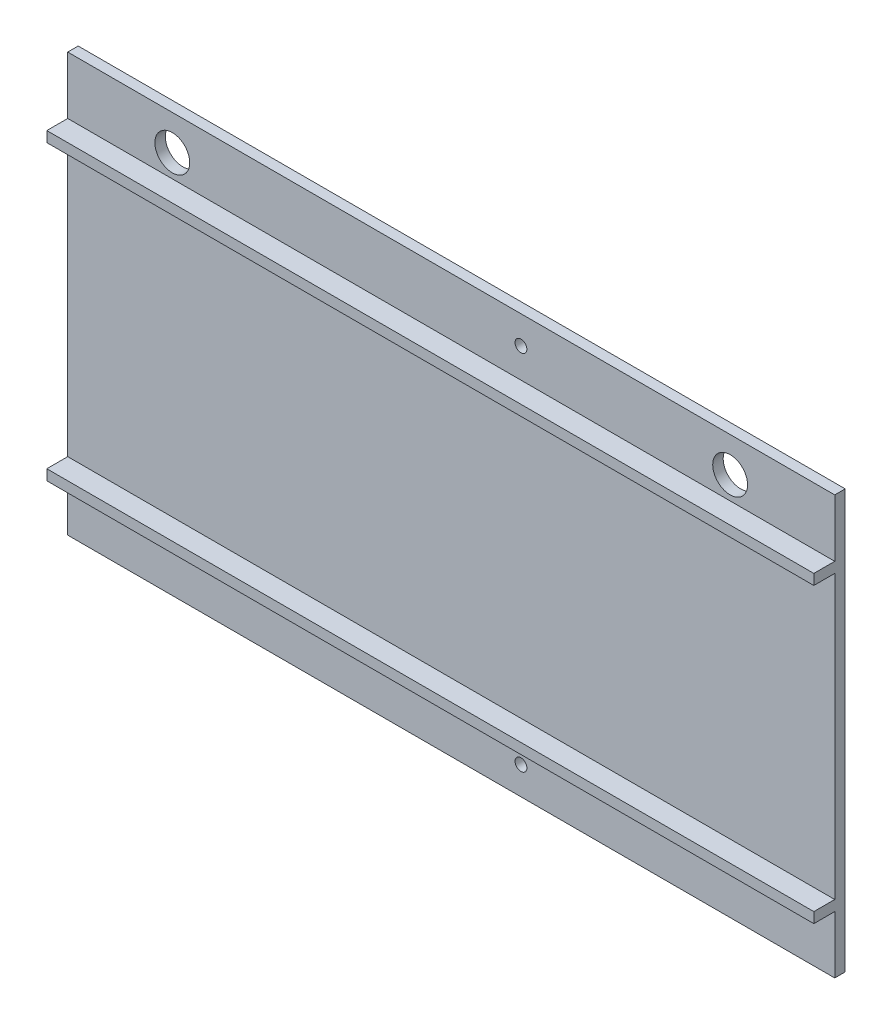
from build123d import *

# Parameters (mm, degrees)
LID_START           = 40
SKETCH_1_W          = 220
SKETCH_1_H          = 120
LID_DEPTH           = 3
RAIL_START          = 40
SKETCH_2_W          = 220
SKETCH_2_H          = 3
RAIL_DEPTH          = 9
EXTRUDE_START       = 40
SKETCH_3_W          = 220
SKETCH_3_H          = 3
EXTRUDE_3_DEPTH     = 9
CABLEHOLE_START     = 39
SKETCH_4_R          = 5
CABLEHOLE_DEPTH     = 5
CUT_EXTRUDE_START   = 39
SKETCH_5_R          = 5
CUT_EXTRUDE_2_DEPTH = 5
TOWERSCREW_START    = 39
SKETCH_6_R          = 1.7
TOWERSCREW_DEPTH    = 5
SKETCH_7_R          = 1.7
CUT_EXTRUDE_4_DEPTH = 5


with BuildPart() as part:
    # 草图1 → Lid (new body)
    with BuildSketch(Plane.XY.offset(LID_START)):
        Rectangle(SKETCH_1_W, SKETCH_1_H)
    extrude(amount=LID_DEPTH)

    # 草图2 → Rail (add)
    with BuildSketch(Plane.XY.offset(RAIL_START)):
        with Locations((0, -42)):
            Rectangle(SKETCH_2_W, SKETCH_2_H)
    extrude(amount=RAIL_DEPTH)

    # 草图3 → 凸台-拉伸3 (add)
    with BuildSketch(Plane.XY.offset(EXTRUDE_START)):
        with Locations((0, 42)):
            Rectangle(SKETCH_3_W, SKETCH_3_H)
    extrude(amount=EXTRUDE_3_DEPTH)

    # 草图4 → CableHole (cut)
    with BuildSketch(Plane.XY.offset(CABLEHOLE_START)):
        with Locations(Location((-80, 50, 0), (0, 0, 180))):
            Circle(SKETCH_4_R)
    extrude(amount=CABLEHOLE_DEPTH, mode=Mode.SUBTRACT)

    # 草图5 → 切除-拉伸2 (cut)
    with BuildSketch(Plane.XY.offset(CUT_EXTRUDE_START)):
        with Locations(Location((80, 50, 0), (0, 0, 180))):
            Circle(SKETCH_5_R)
    extrude(amount=CUT_EXTRUDE_2_DEPTH, mode=Mode.SUBTRACT)

    # 草图6 → TowerScrew (cut)
    with BuildSketch(Plane.XY.offset(TOWERSCREW_START)):
        with Locations(Location((20, -52, 0), (0, 0, 180))):
            Circle(SKETCH_6_R)
    extrude(amount=TOWERSCREW_DEPTH, mode=Mode.SUBTRACT)

    # 草图7 → 切除-拉伸4 (cut)
    with BuildSketch(Plane.XY.offset(CUT_EXTRUDE_START)):
        with Locations(Location((20, 52, 0), (0, 0, 180))):
            Circle(SKETCH_7_R)
    extrude(amount=CUT_EXTRUDE_4_DEPTH, mode=Mode.SUBTRACT)


solid = part.part
